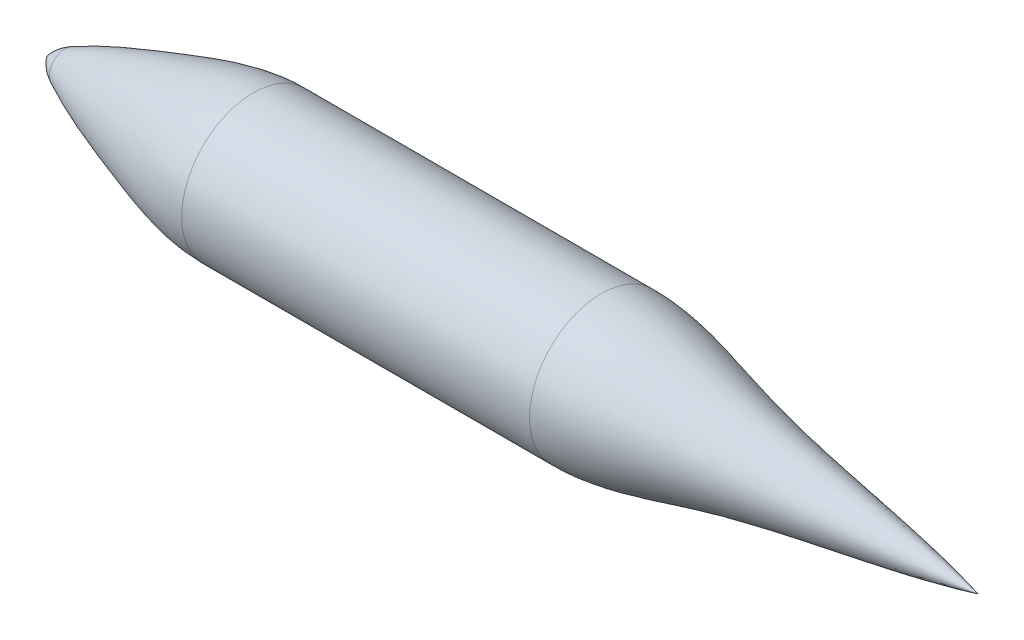
from build123d import *


with BuildPart() as part:
    # Schizzo6 → Rivoluzione1 (revolve)
    with BuildSketch(Plane(origin=(0, 0, 0), x_dir=(-1, 0, 0), z_dir=(0, 1, 0)), mode=Mode.PRIVATE) as rivoluzione1_sk:
        with BuildLine():
            Line((312.8, 33.1), (173.8, 33.1))
            add(Edge.make_bspline(
                [(0, 0), (25.189681618, 6.420690348), (65.524514327, 11.905890776), (123.601815916, 23.198152096), (154.27405796, 33.1), (173.8, 33.1)],
                knots=[0, 0, 0, 0, 0.440523165, 0.694819662, 1, 1, 1, 1], degree=3))
            Line((0, 0), (407.984249418, 0))
            Line((407.984249418, 0), (429.484249418, 0))
            add(Edge.make_bspline(
                [(421.2, 7.24), (424.585391476, 5.536490554), (427.346807948, 3.123157221), (429.484249418, 0)],
                knots=[0, 0, 0, 0, 1, 1, 1, 1], degree=3))
            add(Edge.make_bspline(
                [(334.3, 33.1), (349.712171146, 33.1), (379.219747339, 23.452313445), (407.741660777, 14.0121586), (421.2, 7.24)],
                knots=[0, 0, 0, 0, 0.507344977, 1, 1, 1, 1], degree=3))
            Line((334.3, 33.1), (312.8, 33.1))
        make_face()
    revolve(rivoluzione1_sk.sketch.rotate(Axis((0, 0, 0), (-1, 0, 0)), 180), axis=Axis((0, 0, 0), (-1, 0, 0)))


solid = part.part
